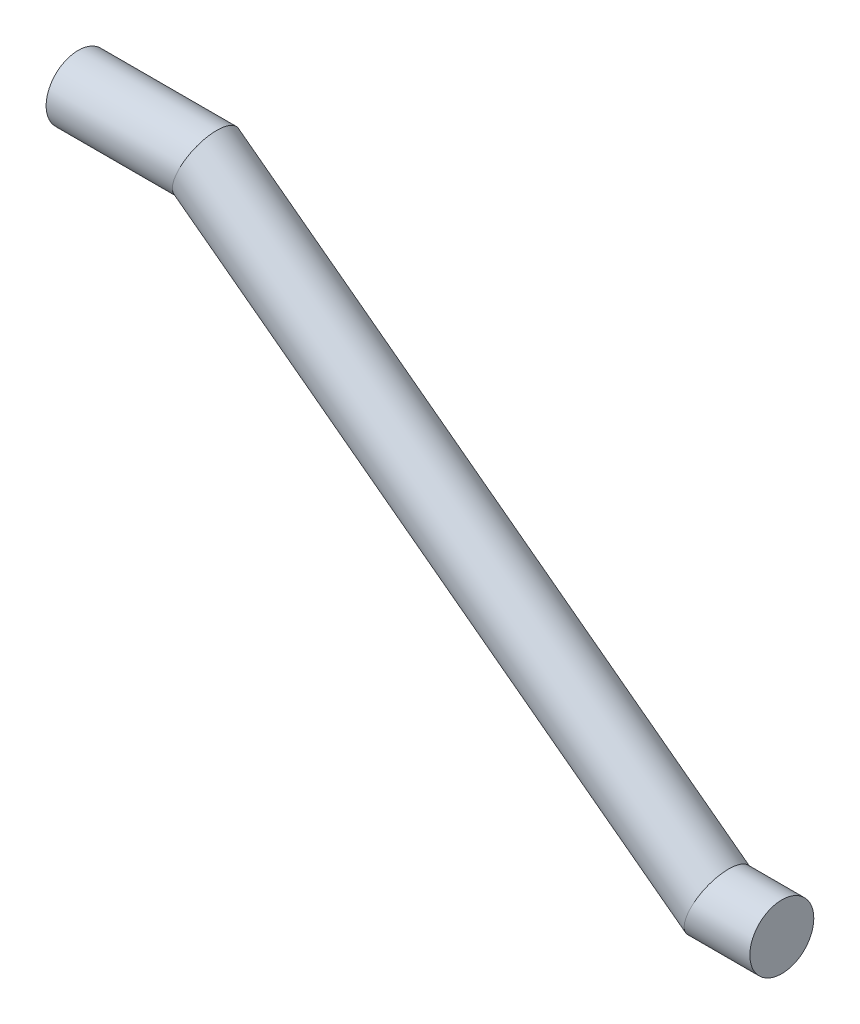
from build123d import *

# Parameters (mm, degrees)
SKETCH1_R = 25


with BuildPart() as part:
    # Sweep1: sweep along a path in Sketch2
    with BuildLine(Plane.XY) as sweep1_path:
        Line((0, 0), (100, 0))
        Line((100, 0), (500, -300))
        Line((500, -300), (550, -300))
    # Sketch1 → Sweep1 (sweep)
    with BuildSketch(Plane(origin=(0, 0, 0), x_dir=(0, 0, -1), z_dir=(1, 0, 0))):
        Circle(SKETCH1_R)
    sweep(path=sweep1_path.line, transition=Transition.RIGHT)


solid = part.part
